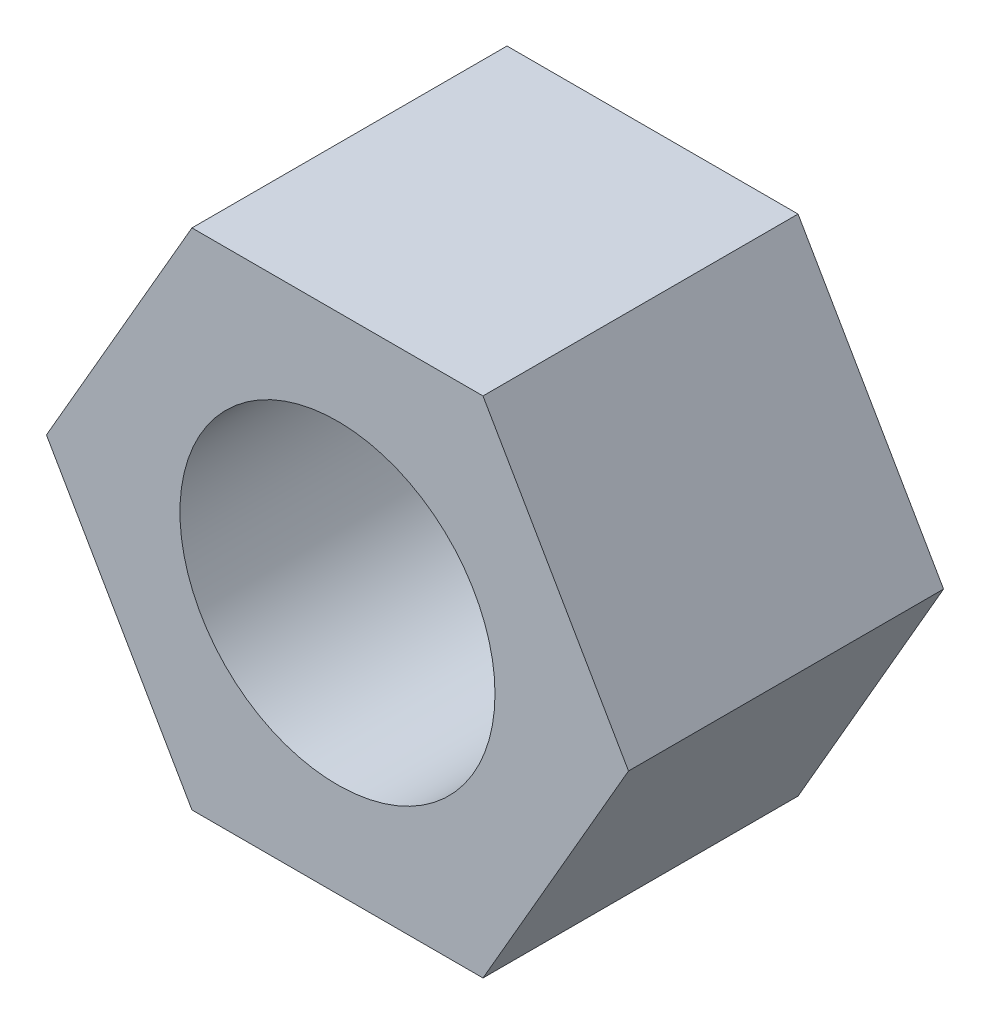
from build123d import *

# Parameters (mm, degrees)
SKETCH_1_R      = 2.5
EXTRUDE_1_DEPTH = 5


with BuildPart() as part:
    # 草图1 → 凸台-拉伸1 (new body)
    with BuildSketch(Plane.XY):
        Polygon((4.618802154, 0), (2.309401077, 4), (-2.309401077, 4), (-4.618802154, 0), (-2.309401077, -4), (2.309401077, -4), align=None)
        Circle(SKETCH_1_R, mode=Mode.SUBTRACT)
    extrude(amount=-EXTRUDE_1_DEPTH)


solid = part.part
